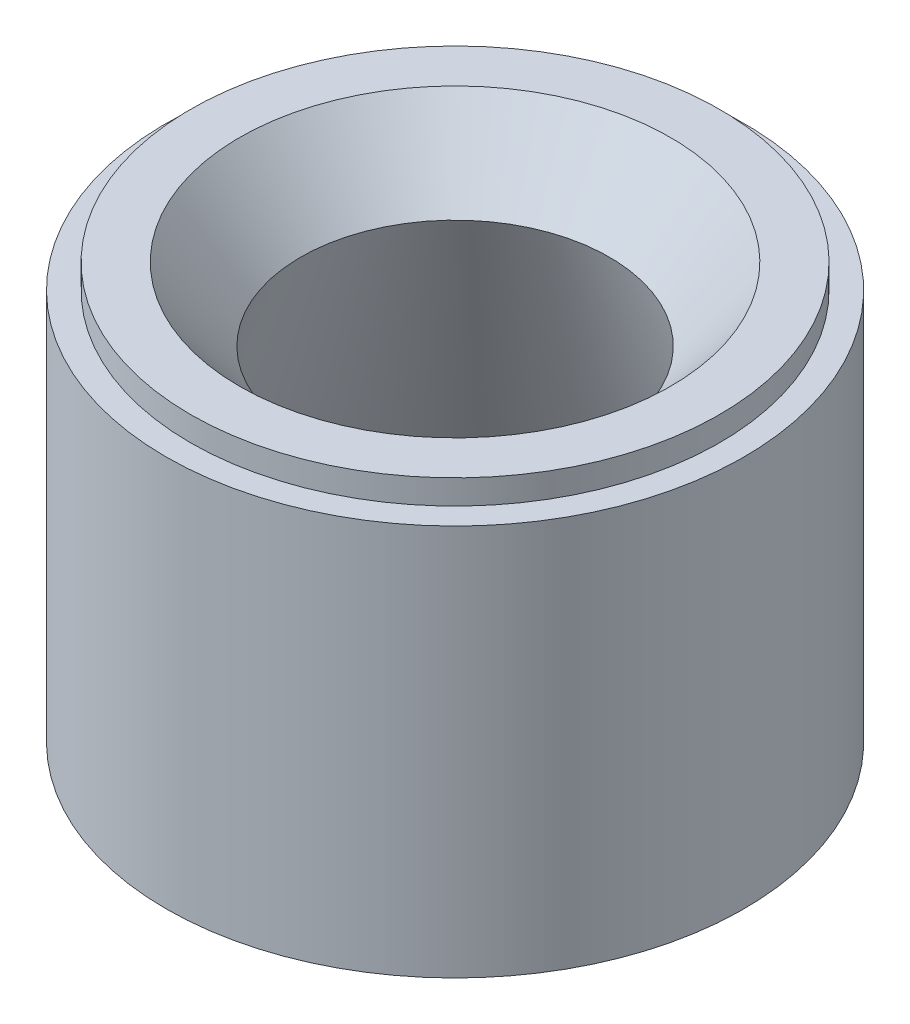
from build123d import *


with BuildPart() as part:
    # Sketch2 → Revolve1 (revolve)
    with BuildSketch(Plane.XY, mode=Mode.PRIVATE) as revolve1_sk:
        Polygon((-55.95, 0), (-68.65, 0), (-68.65, -6.35), (-75, -6.35), (-75, -107.95), (-72.46, -107.95), (-40.061328426, -18.93538143), align=None)
    revolve(revolve1_sk.sketch.rotate(Axis((0, 0, 0), (0, -1, 0)), 270), axis=Axis((0, 0, 0), (0, -1, 0)))


solid = part.part
